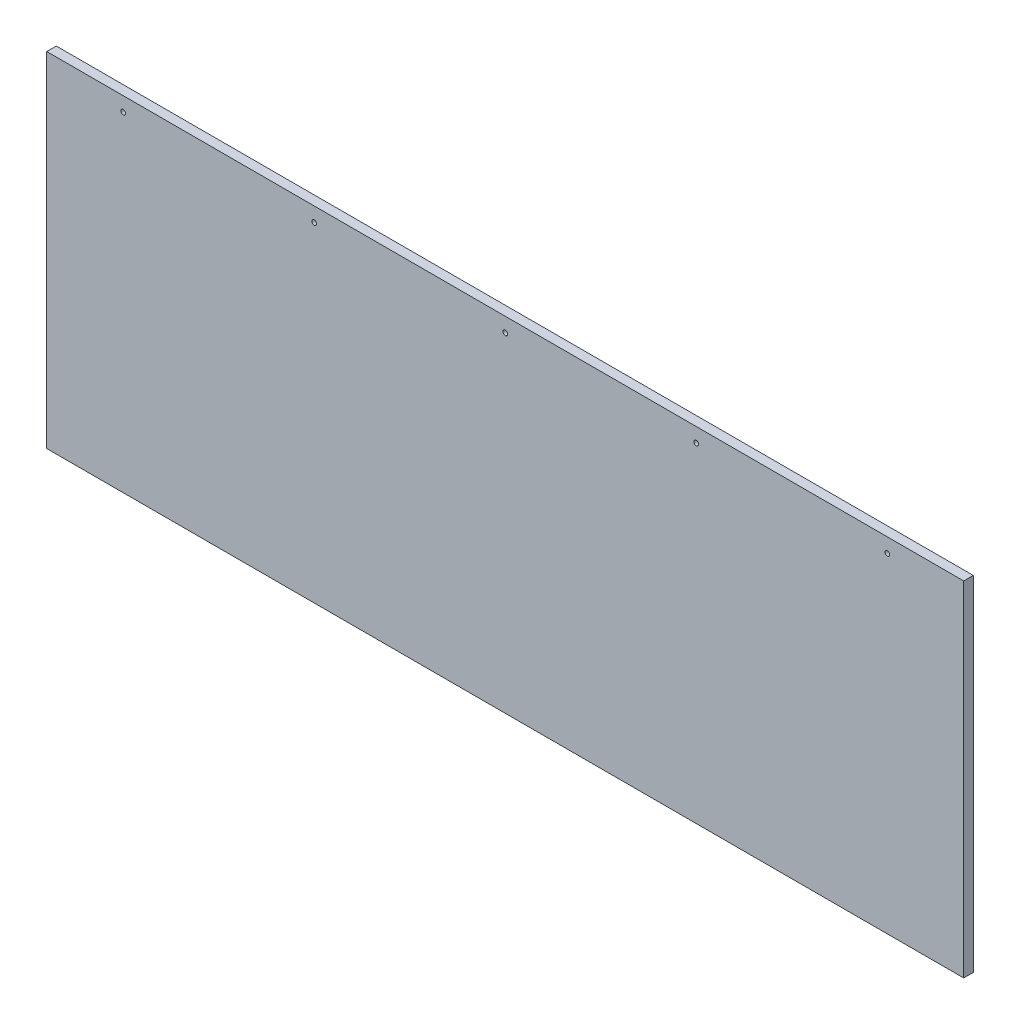
from build123d import *

# Parameters (mm, degrees)
SKETCH1_W           = 1219.2
SKETCH1_H           = 457.2
BOSS_EXTRUDE1_DEPTH = 12.7
SKETCH2_R           = 3.175
CUT_EXTRUDE1_DEPTH  = 1303.168103587


with BuildPart() as part:
    # Sketch1 → Boss-Extrude1 (new body)
    with BuildSketch(Plane.XY):
        with Locations((-609.6, 228.6)):
            Rectangle(SKETCH1_W, SKETCH1_H)
    extrude(amount=BOSS_EXTRUDE1_DEPTH)

    # Sketch2 (on Front Plane) → Cut-Extrude1 (cut, through all)
    with BuildSketch(Plane.XY):
        with Locations((-1117.6, 438.15)):
            Circle(SKETCH2_R)
        with Locations((-863.6, 438.15)):
            Circle(SKETCH2_R)
        with Locations((-609.6, 438.15)):
            Circle(SKETCH2_R)
        with Locations((-355.6, 438.15)):
            Circle(SKETCH2_R)
        with Locations((-101.6, 438.15)):
            Circle(SKETCH2_R)
    extrude(amount=CUT_EXTRUDE1_DEPTH, mode=Mode.SUBTRACT)


solid = part.part
